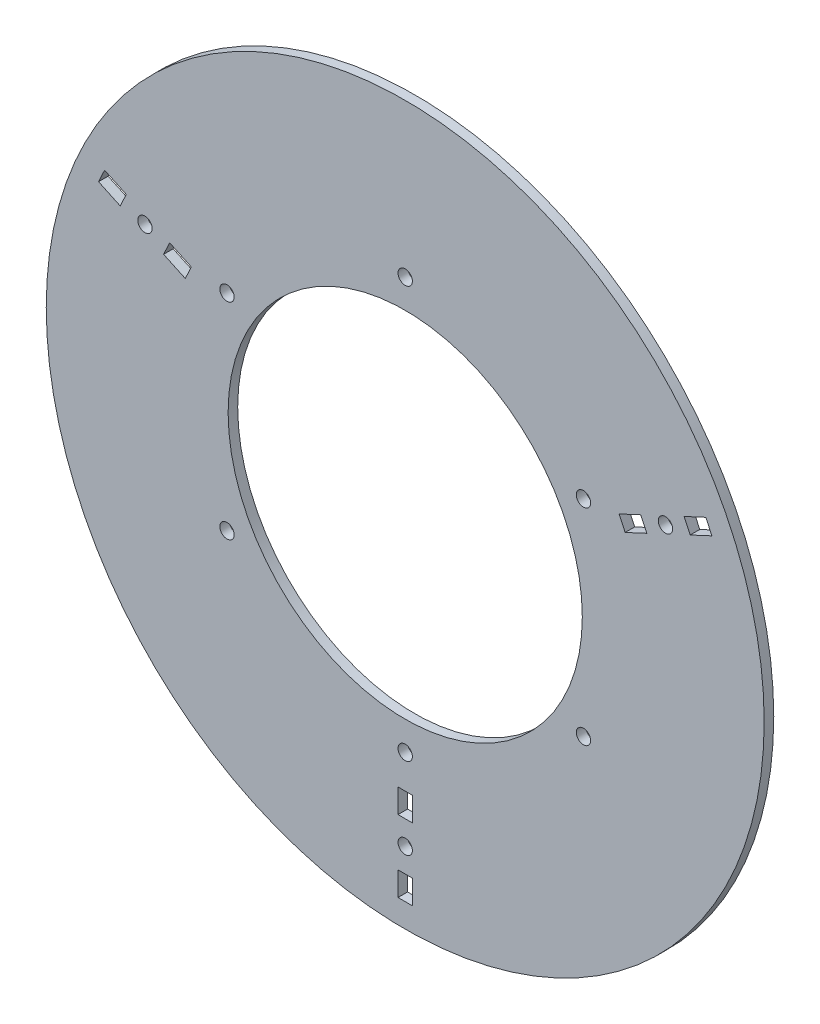
from build123d import *

# Parameters (mm, degrees)
SKETCH1_R           = 75
SKETCH1_R_2         = 37
SKETCH1_R_3         = 1.5
SKETCH1_W           = 3
SKETCH1_H           = 5
BOSS_EXTRUDE1_DEPTH = 2


with BuildPart() as part:
    # Sketch1 → Boss-Extrude1 (new body)
    with BuildSketch(Plane.XY):
        Circle(SKETCH1_R)
        Circle(SKETCH1_R_2, mode=Mode.SUBTRACT)
        with Locations((0, -43)):
            Circle(SKETCH1_R_3, mode=Mode.SUBTRACT)
        with Locations((-37.239092363, -21.5)):
            Circle(SKETCH1_R_3, mode=Mode.SUBTRACT)
        with Locations((-37.239092363, 21.5)):
            Circle(SKETCH1_R_3, mode=Mode.SUBTRACT)
        with Locations((0, 43)):
            Circle(SKETCH1_R_3, mode=Mode.SUBTRACT)
        with Locations((37.239092363, 21.5)):
            Circle(SKETCH1_R_3, mode=Mode.SUBTRACT)
        with Locations((37.239092363, -21.5)):
            Circle(SKETCH1_R_3, mode=Mode.SUBTRACT)
        with Locations((0, -60)):
            Circle(SKETCH1_R_3, mode=Mode.SUBTRACT)
        with Locations((54.378467222, 25.357095704)):
            Circle(SKETCH1_R_3, mode=Mode.SUBTRACT)
        with Locations((-54.378467222, 25.357095704)):
            Circle(SKETCH1_R_3, mode=Mode.SUBTRACT)
        with Locations((0, -52.5)):
            Rectangle(SKETCH1_W, SKETCH1_H, mode=Mode.SUBTRACT)
        with Locations((0, -67.5)):
            Rectangle(SKETCH1_W, SKETCH1_H, mode=Mode.SUBTRACT)
        Polygon((49.213000894, 24.603466076), (44.681461959, 22.490374768), (45.949316744, 19.771451406), (50.48085568, 21.884542715), align=None, mode=Mode.SUBTRACT)
        Polygon((58.276078765, 28.829648694), (62.8076177, 30.942740002), (64.075472485, 28.223816641), (59.54393355, 26.110725333), align=None, mode=Mode.SUBTRACT)
        Polygon((-58.276078765, 28.829648694), (-62.8076177, 30.942740002), (-64.075472485, 28.223816641), (-59.54393355, 26.110725333), align=None, mode=Mode.SUBTRACT)
        Polygon((-49.213000894, 24.603466076), (-44.681461959, 22.490374768), (-45.949316744, 19.771451406), (-50.48085568, 21.884542715), align=None, mode=Mode.SUBTRACT)
    extrude(amount=BOSS_EXTRUDE1_DEPTH)


solid = part.part
